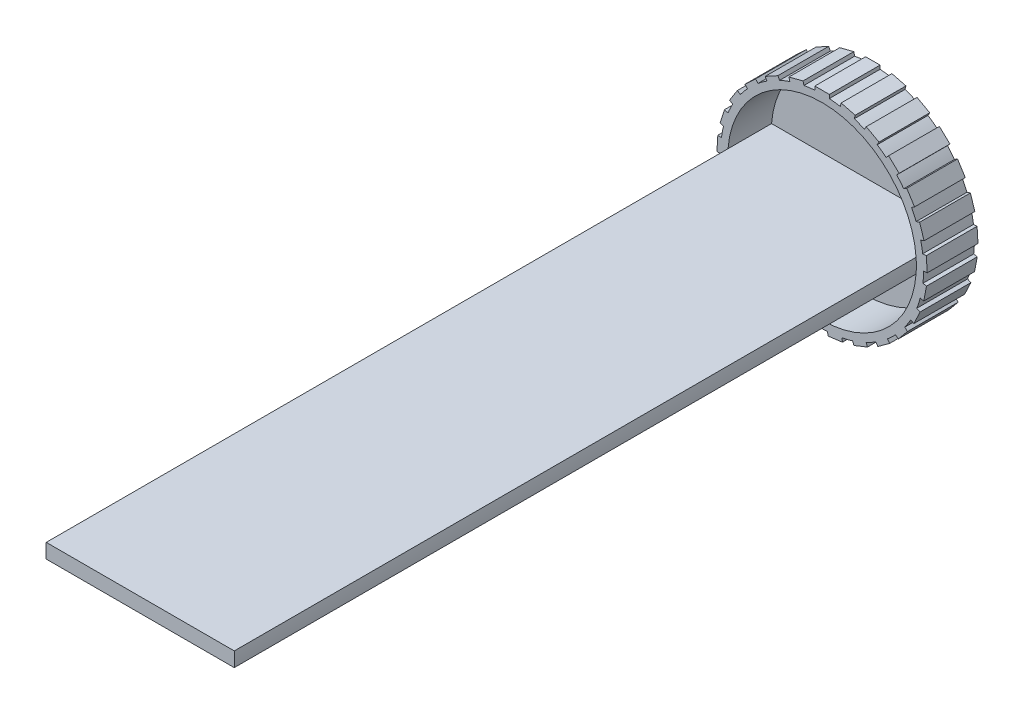
from build123d import *

# Parameters (mm, degrees)
IZIM1_R                     = 65
Y_KSEKLIK_EKSTR_ZYON1_DEPTH = 30
Y_KSEKLIK_EKSTR_ZYON3_START = 5
Y_KSEKLIK_EKSTR_ZYON3_DEPTH = 5
Y_KSEKLIK_EKSTR_ZYON4_DEPTH = 500


with BuildPart() as part:
    # Çizim1 → Yükseklik-Ekstrüzyon1 (new body)
    with BuildSketch(Plane.XY):
        with BuildLine():
            Line((17.985551122, 70.049096725), (13.142635316, 71.29254616))
            Line((13.142635316, 71.29254616), (12.520910598, 68.871088258))
            ThreePointArc((12.520910598, 68.871088258), (8.773326349, 69.448029092), (5, 69.821200219))
            Line((5, 69.821200219), (5, 72.321200219))
            Line((5, 72.321200219), (0, 72.321200219))
            Line((0, 72.321200219), (-5, 72.321200219))
            Line((-5, 72.321200219), (-5, 69.821200219))
            ThreePointArc((-5, 69.821200219), (-8.77332635, 69.448029092), (-12.520910599, 68.871088258))
            Line((-12.520910599, 68.871088258), (-13.142635316, 71.29254616))
            Line((-13.142635316, 71.29254616), (-17.985551122, 70.049096725))
            Line((-17.985551122, 70.049096725), (-22.828466928, 68.805647289))
            Line((-22.828466928, 68.805647289), (-22.20674221, 66.384189386))
            ThreePointArc((-22.20674221, 66.384189386), (-25.768718688, 65.084354012), (-29.255086335, 63.593552531))
            Line((-29.255086335, 63.593552531), (-30.459470521, 65.784319231))
            Line((-30.459470521, 65.784319231), (-34.841003921, 63.375550861))
            Line((-34.841003921, 63.375550861), (-39.222537321, 60.96678249))
            Line((-39.222537321, 60.96678249), (-38.018153136, 58.77601579))
            ThreePointArc((-38.018153136, 58.77601579), (-41.14496766, 56.631189606), (-44.151057405, 54.320200018))
            Line((-44.151057405, 54.320200018), (-45.86242517, 56.142621587))
            Line((-45.86242517, 56.142621587), (-49.507268307, 52.719886057))
            Line((-49.507268307, 52.719886057), (-53.152111444, 49.297150527))
            Line((-53.152111444, 49.297150527), (-51.440743679, 47.474728959))
            ThreePointArc((-51.440743679, 47.474728959), (-53.935926994, 44.619679282), (-56.272855162, 41.633709562))
            Line((-56.272855162, 41.633709562), (-58.383674976, 42.97327655))
            Line((-58.383674976, 42.97327655), (-61.062808951, 38.751636922))
            Line((-61.062808951, 38.751636922), (-63.741942925, 34.529997295))
            Line((-63.741942925, 34.529997295), (-61.631123112, 33.190430307))
            ThreePointArc((-61.631123112, 33.190430307), (-63.337893673, 29.80455041), (-64.858822472, 26.331220017))
            Line((-64.858822472, 26.331220017), (-67.236463763, 27.103762503))
            Line((-67.236463763, 27.103762503), (-68.781548734, 22.348479921))
            Line((-68.781548734, 22.348479921), (-70.326633706, 17.59319734))
            Line((-70.326633706, 17.59319734), (-67.948992416, 16.820654854))
            ThreePointArc((-67.948992416, 16.820654854), (-68.760107551, 13.116692021), (-69.369471432, 9.374243078))
            Line((-69.369471432, 9.374243078), (-71.864538253, 9.531219377))
            Line((-71.864538253, 9.531219377), (-72.17849085, 4.541085735))
            Line((-72.17849085, 4.541085735), (-72.492443448, -0.449047907))
            Line((-72.492443448, -0.449047907), (-69.997376627, -0.606024206))
            ThreePointArc((-69.997376627, -0.606024206), (-69.86187099, -4.395336367), (-69.521381378, -8.171752029))
            Line((-69.521381378, -8.171752029), (-71.977099505, -8.640205316))
            Line((-71.977099505, -8.640205316), (-71.040192932, -13.551641569))
            Line((-71.040192932, -13.551641569), (-70.103286359, -18.463077823))
            Line((-70.103286359, -18.463077823), (-67.647568233, -17.994624537))
            ThreePointArc((-67.647568233, -17.994624537), (-66.573956141, -21.631189606), (-65.305007251, -25.204285903))
            Line((-65.305007251, -25.204285903), (-67.567074883, -26.268734132))
            Line((-67.567074883, -26.268734132), (-65.438178425, -30.792869394))
            Line((-65.438178425, -30.792869394), (-63.309281967, -35.317004657))
            Line((-63.309281967, -35.317004657), (-61.047214336, -34.252556428))
            ThreePointArc((-61.047214336, -34.252556428), (-59.102954785, -37.507875649), (-56.985279344, -40.653141799))
            Line((-56.985279344, -40.653141799), (-58.911562451, -42.246701773))
            Line((-58.911562451, -42.246701773), (-55.724442502, -46.099267987))
            Line((-55.724442502, -46.099267987), (-52.537322553, -49.951834201))
            Line((-52.537322553, -49.951834201), (-50.611039446, -48.358274226))
            ThreePointArc((-50.611039446, -48.358274226), (-47.918297415, -51.02780392), (-45.084956758, -53.547611283))
            Line((-45.084956758, -53.547611283), (-46.554419889, -55.570153769))
            Line((-46.554419889, -55.570153769), (-42.509334917, -58.509080031))
            Line((-42.509334917, -58.509080031), (-38.464249945, -61.448006292))
            Line((-38.464249945, -61.448006292), (-36.994786814, -59.425463806))
            ThreePointArc((-36.994786814, -59.425463806), (-33.722757187, -61.341467603), (-30.351780528, -63.077487417))
            Line((-30.351780528, -63.077487417), (-31.27209191, -65.401928631))
            Line((-31.27209191, -65.401928631), (-26.62320948, -67.242551395))
            Line((-26.62320948, -67.242551395), (-21.974327051, -69.083174158))
            Line((-21.974327051, -69.083174158), (-21.054015669, -66.758732943))
            ThreePointArc((-21.054015669, -66.758732943), (-17.408292102, -67.800821279), (-13.711490301, -68.643973033))
            Line((-13.711490301, -68.643973033), (-14.024823385, -71.124259786))
            Line((-14.024823385, -71.124259786), (-9.064249879, -71.750925954))
            Line((-9.064249879, -71.750925954), (-4.103676372, -72.377592122))
            Line((-4.103676372, -72.377592122), (-3.790343288, -69.897305368))
            ThreePointArc((-3.790343288, -69.897305368), (0, -70), (3.790343288, -69.897305368))
            Line((3.790343288, -69.897305368), (4.103676372, -72.377592122))
            Line((4.103676372, -72.377592122), (9.064249879, -71.750925954))
            Line((9.064249879, -71.750925954), (14.024823385, -71.124259786))
            Line((14.024823385, -71.124259786), (13.711490301, -68.643973033))
            ThreePointArc((13.711490301, -68.643973033), (17.408292102, -67.800821279), (21.054015669, -66.758732943))
            Line((21.054015669, -66.758732943), (21.974327051, -69.083174158))
            Line((21.974327051, -69.083174158), (26.62320948, -67.242551395))
            Line((26.62320948, -67.242551395), (31.27209191, -65.401928631))
            Line((31.27209191, -65.401928631), (30.351780528, -63.077487417))
            ThreePointArc((30.351780528, -63.077487417), (33.722757187, -61.341467603), (36.994786814, -59.425463806))
            Line((36.994786814, -59.425463806), (38.464249945, -61.448006292))
            Line((38.464249945, -61.448006292), (42.509334917, -58.509080031))
            Line((42.509334917, -58.509080031), (46.554419889, -55.570153769))
            Line((46.554419889, -55.570153769), (45.084956758, -53.547611283))
            ThreePointArc((45.084956758, -53.547611283), (47.918297415, -51.027803919), (50.611039446, -48.358274226))
            Line((50.611039446, -48.358274226), (52.537322553, -49.951834201))
            Line((52.537322553, -49.951834201), (55.724442502, -46.099267987))
            Line((55.724442502, -46.099267987), (58.911562451, -42.246701773))
            Line((58.911562451, -42.246701773), (56.985279344, -40.653141799))
            ThreePointArc((56.985279344, -40.653141799), (59.102954785, -37.507875649), (61.047214336, -34.252556428))
            Line((61.047214336, -34.252556428), (63.309281967, -35.317004657))
            Line((63.309281967, -35.317004657), (65.438178425, -30.792869394))
            Line((65.438178425, -30.792869394), (67.567074883, -26.268734132))
            Line((67.567074883, -26.268734132), (65.305007251, -25.204285903))
            ThreePointArc((65.305007251, -25.204285903), (66.573956141, -21.631189606), (67.647568233, -17.994624537))
            Line((67.647568233, -17.994624537), (70.103286359, -18.463077823))
            Line((70.103286359, -18.463077823), (71.040192932, -13.551641569))
            Line((71.040192932, -13.551641569), (71.977099505, -8.640205316))
            Line((71.977099505, -8.640205316), (69.521381378, -8.171752029))
            ThreePointArc((69.521381378, -8.171752029), (69.86187099, -4.395336367), (69.997376627, -0.606024206))
            Line((69.997376627, -0.606024206), (72.492443448, -0.449047907))
            Line((72.492443448, -0.449047907), (72.17849085, 4.541085735))
            Line((72.17849085, 4.541085735), (71.864538253, 9.531219377))
            Line((71.864538253, 9.531219377), (69.369471432, 9.374243078))
            ThreePointArc((69.369471432, 9.374243078), (68.760107551, 13.116692021), (67.948992416, 16.820654854))
            Line((67.948992416, 16.820654854), (70.326633706, 17.59319734))
            Line((70.326633706, 17.59319734), (68.781548734, 22.348479921))
            Line((68.781548734, 22.348479921), (67.236463763, 27.103762503))
            Line((67.236463763, 27.103762503), (64.858822472, 26.331220017))
            ThreePointArc((64.858822472, 26.331220017), (63.337893673, 29.80455041), (61.631123112, 33.190430307))
            Line((61.631123112, 33.190430307), (63.741942925, 34.529997295))
            Line((63.741942925, 34.529997295), (61.062808951, 38.751636922))
            Line((61.062808951, 38.751636922), (58.383674976, 42.97327655))
            Line((58.383674976, 42.97327655), (56.272855162, 41.633709562))
            ThreePointArc((56.272855162, 41.633709562), (53.935926994, 44.619679282), (51.440743679, 47.474728959))
            Line((51.440743679, 47.474728959), (53.152111444, 49.297150527))
            Line((53.152111444, 49.297150527), (49.507268307, 52.719886057))
            Line((49.507268307, 52.719886057), (45.86242517, 56.142621587))
            Line((45.86242517, 56.142621587), (44.151057405, 54.320200018))
            ThreePointArc((44.151057405, 54.320200018), (41.14496766, 56.631189606), (38.018153136, 58.77601579))
            Line((38.018153136, 58.77601579), (39.222537321, 60.96678249))
            Line((39.222537321, 60.96678249), (34.841003921, 63.375550861))
            Line((34.841003921, 63.375550861), (30.459470521, 65.784319231))
            Line((30.459470521, 65.784319231), (29.255086335, 63.593552531))
            ThreePointArc((29.255086335, 63.593552531), (25.768718688, 65.084354012), (22.20674221, 66.384189386))
            Line((22.20674221, 66.384189386), (22.828466928, 68.805647289))
            Line((22.828466928, 68.805647289), (17.985551122, 70.049096725))
        make_face()
        Circle(IZIM1_R, mode=Mode.SUBTRACT)
    extrude(amount=Y_KSEKLIK_EKSTR_ZYON1_DEPTH)

    # Çizim2 → Yükseklik-Ekstrüzyon3 (add)
    with BuildSketch(Plane(origin=(0, 0, 0), x_dir=(-1, 0, 0), z_dir=(0, 0, -1)).offset(Y_KSEKLIK_EKSTR_ZYON3_START)):
        with BuildLine():
            Line((17.985551122, 70.049096725), (13.142635316, 71.29254616))
            Line((13.142635316, 71.29254616), (12.520910598, 68.871088258))
            ThreePointArc((12.520910598, 68.871088258), (8.773326349, 69.448029092), (5, 69.821200219))
            Line((5, 69.821200219), (5, 72.321200219))
            Line((5, 72.321200219), (0, 72.321200219))
            Line((0, 72.321200219), (-5, 72.321200219))
            Line((-5, 72.321200219), (-5, 69.821200219))
            ThreePointArc((-5, 69.821200219), (-8.77332635, 69.448029092), (-12.520910599, 68.871088258))
            Line((-12.520910599, 68.871088258), (-13.142635316, 71.29254616))
            Line((-13.142635316, 71.29254616), (-17.985551122, 70.049096725))
            Line((-17.985551122, 70.049096725), (-22.828466928, 68.805647289))
            Line((-22.828466928, 68.805647289), (-22.20674221, 66.384189386))
            ThreePointArc((-22.20674221, 66.384189386), (-25.768718688, 65.084354012), (-29.255086335, 63.593552531))
            Line((-29.255086335, 63.593552531), (-30.459470521, 65.784319231))
            Line((-30.459470521, 65.784319231), (-34.841003921, 63.375550861))
            Line((-34.841003921, 63.375550861), (-39.222537321, 60.96678249))
            Line((-39.222537321, 60.96678249), (-38.018153136, 58.77601579))
            ThreePointArc((-38.018153136, 58.77601579), (-41.14496766, 56.631189606), (-44.151057405, 54.320200018))
            Line((-44.151057405, 54.320200018), (-45.86242517, 56.142621587))
            Line((-45.86242517, 56.142621587), (-49.507268307, 52.719886057))
            Line((-49.507268307, 52.719886057), (-53.152111444, 49.297150527))
            Line((-53.152111444, 49.297150527), (-51.440743679, 47.474728959))
            ThreePointArc((-51.440743679, 47.474728959), (-53.935926994, 44.619679282), (-56.272855162, 41.633709562))
            Line((-56.272855162, 41.633709562), (-58.383674976, 42.97327655))
            Line((-58.383674976, 42.97327655), (-61.062808951, 38.751636922))
            Line((-61.062808951, 38.751636922), (-63.741942925, 34.529997295))
            Line((-63.741942925, 34.529997295), (-61.631123112, 33.190430307))
            ThreePointArc((-61.631123112, 33.190430307), (-63.337893673, 29.80455041), (-64.858822472, 26.331220017))
            Line((-64.858822472, 26.331220017), (-67.236463763, 27.103762503))
            Line((-67.236463763, 27.103762503), (-68.781548734, 22.348479921))
            Line((-68.781548734, 22.348479921), (-70.326633706, 17.59319734))
            Line((-70.326633706, 17.59319734), (-67.948992416, 16.820654854))
            ThreePointArc((-67.948992416, 16.820654854), (-68.760107551, 13.116692021), (-69.369471432, 9.374243078))
            Line((-69.369471432, 9.374243078), (-71.864538253, 9.531219377))
            Line((-71.864538253, 9.531219377), (-72.17849085, 4.541085735))
            Line((-72.17849085, 4.541085735), (-72.492443448, -0.449047907))
            Line((-72.492443448, -0.449047907), (-69.997376627, -0.606024206))
            ThreePointArc((-69.997376627, -0.606024206), (-69.86187099, -4.395336367), (-69.521381378, -8.171752029))
            Line((-69.521381378, -8.171752029), (-71.977099505, -8.640205316))
            Line((-71.977099505, -8.640205316), (-71.040192932, -13.551641569))
            Line((-71.040192932, -13.551641569), (-70.103286359, -18.463077823))
            Line((-70.103286359, -18.463077823), (-67.647568233, -17.994624537))
            ThreePointArc((-67.647568233, -17.994624537), (-66.573956141, -21.631189606), (-65.305007251, -25.204285903))
            Line((-65.305007251, -25.204285903), (-67.567074883, -26.268734132))
            Line((-67.567074883, -26.268734132), (-65.438178425, -30.792869394))
            Line((-65.438178425, -30.792869394), (-63.309281967, -35.317004657))
            Line((-63.309281967, -35.317004657), (-61.047214336, -34.252556428))
            ThreePointArc((-61.047214336, -34.252556428), (-59.102954785, -37.507875649), (-56.985279344, -40.653141799))
            Line((-56.985279344, -40.653141799), (-58.911562451, -42.246701773))
            Line((-58.911562451, -42.246701773), (-55.724442502, -46.099267987))
            Line((-55.724442502, -46.099267987), (-52.537322553, -49.951834201))
            Line((-52.537322553, -49.951834201), (-50.611039446, -48.358274226))
            ThreePointArc((-50.611039446, -48.358274226), (-47.918297415, -51.02780392), (-45.084956758, -53.547611283))
            Line((-45.084956758, -53.547611283), (-46.554419889, -55.570153769))
            Line((-46.554419889, -55.570153769), (-42.509334917, -58.509080031))
            Line((-42.509334917, -58.509080031), (-38.464249945, -61.448006292))
            Line((-38.464249945, -61.448006292), (-36.994786814, -59.425463806))
            ThreePointArc((-36.994786814, -59.425463806), (-33.722757187, -61.341467603), (-30.351780528, -63.077487417))
            Line((-30.351780528, -63.077487417), (-31.27209191, -65.401928631))
            Line((-31.27209191, -65.401928631), (-26.62320948, -67.242551395))
            Line((-26.62320948, -67.242551395), (-21.974327051, -69.083174158))
            Line((-21.974327051, -69.083174158), (-21.054015669, -66.758732943))
            ThreePointArc((-21.054015669, -66.758732943), (-17.408292102, -67.800821279), (-13.711490301, -68.643973033))
            Line((-13.711490301, -68.643973033), (-14.024823385, -71.124259786))
            Line((-14.024823385, -71.124259786), (-9.064249879, -71.750925954))
            Line((-9.064249879, -71.750925954), (-4.103676372, -72.377592122))
            Line((-4.103676372, -72.377592122), (-3.790343288, -69.897305368))
            ThreePointArc((-3.790343288, -69.897305368), (0, -70), (3.790343288, -69.897305368))
            Line((3.790343288, -69.897305368), (4.103676372, -72.377592122))
            Line((4.103676372, -72.377592122), (9.064249879, -71.750925954))
            Line((9.064249879, -71.750925954), (14.024823385, -71.124259786))
            Line((14.024823385, -71.124259786), (13.711490301, -68.643973033))
            ThreePointArc((13.711490301, -68.643973033), (17.408292102, -67.800821279), (21.054015669, -66.758732943))
            Line((21.054015669, -66.758732943), (21.974327051, -69.083174158))
            Line((21.974327051, -69.083174158), (26.62320948, -67.242551395))
            Line((26.62320948, -67.242551395), (31.27209191, -65.401928631))
            Line((31.27209191, -65.401928631), (30.351780528, -63.077487417))
            ThreePointArc((30.351780528, -63.077487417), (33.722757187, -61.341467603), (36.994786814, -59.425463806))
            Line((36.994786814, -59.425463806), (38.464249945, -61.448006292))
            Line((38.464249945, -61.448006292), (42.509334917, -58.509080031))
            Line((42.509334917, -58.509080031), (46.554419889, -55.570153769))
            Line((46.554419889, -55.570153769), (45.084956758, -53.547611283))
            ThreePointArc((45.084956758, -53.547611283), (47.918297415, -51.027803919), (50.611039446, -48.358274226))
            Line((50.611039446, -48.358274226), (52.537322553, -49.951834201))
            Line((52.537322553, -49.951834201), (55.724442502, -46.099267987))
            Line((55.724442502, -46.099267987), (58.911562451, -42.246701773))
            Line((58.911562451, -42.246701773), (56.985279344, -40.653141799))
            ThreePointArc((56.985279344, -40.653141799), (59.102954785, -37.507875649), (61.047214336, -34.252556428))
            Line((61.047214336, -34.252556428), (63.309281967, -35.317004657))
            Line((63.309281967, -35.317004657), (65.438178425, -30.792869394))
            Line((65.438178425, -30.792869394), (67.567074883, -26.268734132))
            Line((67.567074883, -26.268734132), (65.305007251, -25.204285903))
            ThreePointArc((65.305007251, -25.204285903), (66.573956141, -21.631189606), (67.647568233, -17.994624537))
            Line((67.647568233, -17.994624537), (70.103286359, -18.463077823))
            Line((70.103286359, -18.463077823), (71.040192932, -13.551641569))
            Line((71.040192932, -13.551641569), (71.977099505, -8.640205316))
            Line((71.977099505, -8.640205316), (69.521381378, -8.171752029))
            ThreePointArc((69.521381378, -8.171752029), (69.86187099, -4.395336367), (69.997376627, -0.606024206))
            Line((69.997376627, -0.606024206), (72.492443448, -0.449047907))
            Line((72.492443448, -0.449047907), (72.17849085, 4.541085735))
            Line((72.17849085, 4.541085735), (71.864538253, 9.531219377))
            Line((71.864538253, 9.531219377), (69.369471432, 9.374243078))
            ThreePointArc((69.369471432, 9.374243078), (68.760107551, 13.116692021), (67.948992416, 16.820654854))
            Line((67.948992416, 16.820654854), (70.326633706, 17.59319734))
            Line((70.326633706, 17.59319734), (68.781548734, 22.348479921))
            Line((68.781548734, 22.348479921), (67.236463763, 27.103762503))
            Line((67.236463763, 27.103762503), (64.858822472, 26.331220017))
            ThreePointArc((64.858822472, 26.331220017), (63.337893673, 29.80455041), (61.631123112, 33.190430307))
            Line((61.631123112, 33.190430307), (63.741942925, 34.529997295))
            Line((63.741942925, 34.529997295), (61.062808951, 38.751636922))
            Line((61.062808951, 38.751636922), (58.383674976, 42.97327655))
            Line((58.383674976, 42.97327655), (56.272855162, 41.633709562))
            ThreePointArc((56.272855162, 41.633709562), (53.935926994, 44.619679282), (51.440743679, 47.474728959))
            Line((51.440743679, 47.474728959), (53.152111444, 49.297150527))
            Line((53.152111444, 49.297150527), (49.507268307, 52.719886057))
            Line((49.507268307, 52.719886057), (45.86242517, 56.142621587))
            Line((45.86242517, 56.142621587), (44.151057405, 54.320200018))
            ThreePointArc((44.151057405, 54.320200018), (41.14496766, 56.631189606), (38.018153136, 58.77601579))
            Line((38.018153136, 58.77601579), (39.222537321, 60.96678249))
            Line((39.222537321, 60.96678249), (34.841003921, 63.375550861))
            Line((34.841003921, 63.375550861), (30.459470521, 65.784319231))
            Line((30.459470521, 65.784319231), (29.255086335, 63.593552531))
            ThreePointArc((29.255086335, 63.593552531), (25.768718688, 65.084354012), (22.20674221, 66.384189386))
            Line((22.20674221, 66.384189386), (22.828466928, 68.805647289))
            Line((22.828466928, 68.805647289), (17.985551122, 70.049096725))
        make_face()
    extrude(amount=-Y_KSEKLIK_EKSTR_ZYON3_DEPTH)

    # Çizim3 → Yükseklik-Ekstrüzyon4 (add)
    with BuildSketch(Plane.XY):
        with BuildLine():
            Line((-64.807406984, 5), (64.807406984, 5))
            ThreePointArc((64.807406984, 5), (65, 0), (64.807406984, -5))
            Line((64.807406984, -5), (-64.807406984, -5))
            ThreePointArc((-64.807406984, -5), (-65, 0), (-64.807406984, 5))
        make_face()
    extrude(amount=Y_KSEKLIK_EKSTR_ZYON4_DEPTH)


solid = part.part
